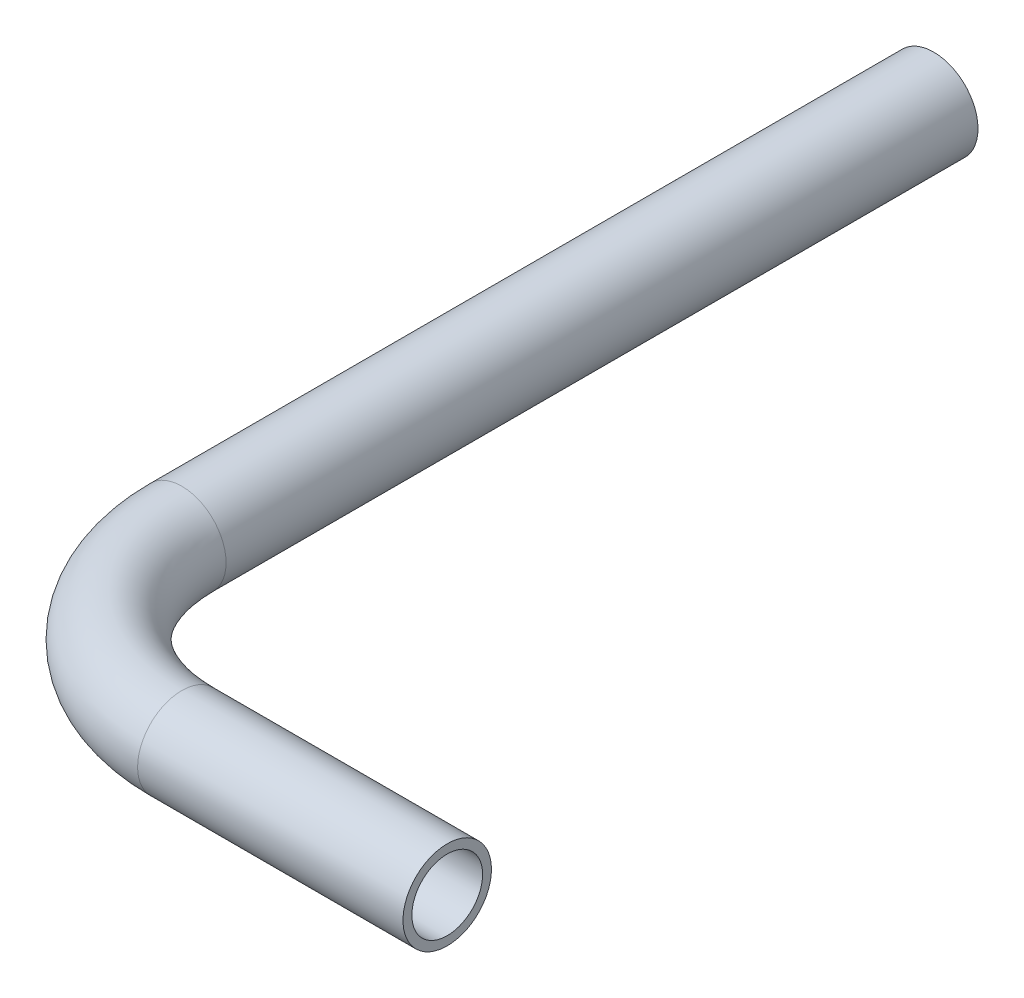
from build123d import *

# Parameters (mm, degrees)
SKETCH2_R   = 6.35
SKETCH2_R_2 = 5.08


with BuildPart() as part:
    # Sweep-Thin1: sweep along a path in Sketch1
    with BuildLine(Plane(origin=(0, 0, 0), x_dir=(1, 0, 0), z_dir=(0, 1, 0))) as sweep_thin1_path:
        Line((0, 0), (0, -107.95))
        ThreePointArc((0, -107.95), (7.439487758, -125.910512242), (25.4, -133.35))
        Line((25.4, -133.35), (63.5, -133.35))
    # Sketch2 → Sweep-Thin1 (sweep)
    with BuildSketch(Plane.XY):
        Circle(SKETCH2_R)
        Circle(SKETCH2_R_2, mode=Mode.SUBTRACT)
    sweep(path=sweep_thin1_path.line)


solid = part.part
